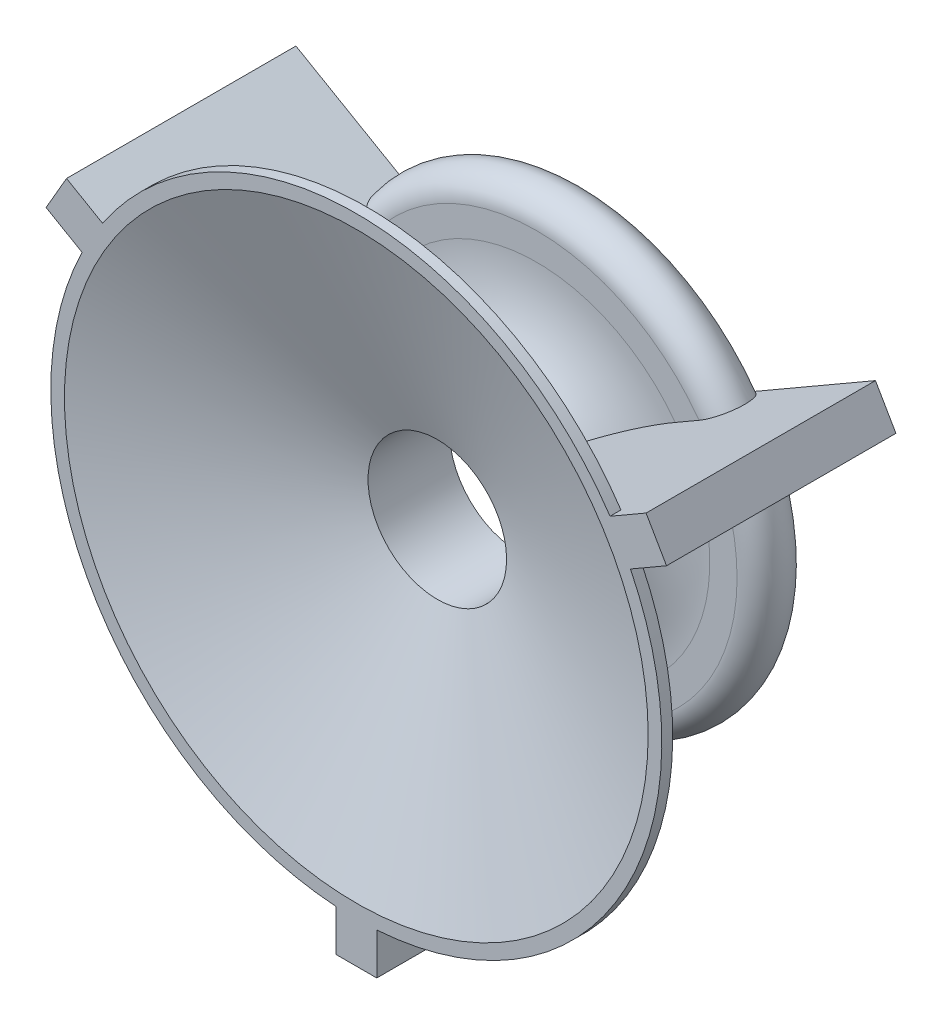
from build123d import *

# Parameters (mm, degrees)
BOSS_EXTRUDE2_DEPTH = 7.5
CIRPATTERN1_COUNT   = 3


with BuildPart() as part:
    # Sketch1 → Revolve1 (revolve)
    with BuildSketch(Plane.YZ):
        with BuildLine():
            Line((-107, 34.699971116), (-112, 34.699971116))
            Line((-112, 34.699971116), (-112, 30.699971116))
            Line((-112, 30.699971116), (-107.705307923, 30.699971116))
            Line((-107.705307923, 30.699971116), (-30.4, 2.563140081))
            Line((-30.4, 2.563140081), (-30.4, -19.471112681))
            ThreePointArc((-30.4, -19.471112681), (-45.908039104, -28.32676528), (-63.5, -31.4))
            Line((-63.5, -31.4), (-73.5, -31.4))
            ThreePointArc((-73.5, -31.4), (-82.5, -40.4), (-73.5, -49.4))
            Line((-73.5, -49.4), (-63.5, -49.4))
            Line((-63.5, -49.4), (-63.5, -45.4))
            Line((-63.5, -45.4), (-73.5, -45.4))
            ThreePointArc((-73.5, -45.4), (-78.5, -40.4), (-73.5, -35.4))
            Line((-73.5, -35.4), (-63.5, -35.4))
            ThreePointArc((-63.5, -35.4), (-46.370880058, -32.710274545), (-30.890538183, -24.9))
            Line((-30.890538183, -24.9), (-25.4, -24.9))
            Line((-25.4, -24.9), (-25.4, 5))
            Line((-25.4, 5), (-107, 34.699971116))
        make_face()
    revolve(axis=Axis((0, 0, 59.888434314), (0, 0, -1)))

    # Sketch1<4> → Boss-Extrude2 (add, symmetric)
    with BuildSketch(Plane.YZ):
        with BuildLine():
            Line((-127, 34.699971116), (-127, -49.4))
            Line((-127, -49.4), (-63.5, -49.4))
            Line((-63.5, -49.4), (-63.5, -45.4))
            Line((-63.5, -45.4), (-73.5, -45.4))
            ThreePointArc((-73.5, -45.4), (-78.5, -40.4), (-73.5, -35.4))
            Line((-73.5, -35.4), (-63.5, -35.4))
            ThreePointArc((-63.5, -35.4), (-43.026785792, -31.514964088), (-25.4, -20.4))
            Line((-25.4, -20.4), (-25.4, 5))
            Line((-25.4, 5), (-107, 34.699971116))
            Line((-107, 34.699971116), (-127, 34.699971116))
        make_face()
    boss_extrude2 = extrude(amount=BOSS_EXTRUDE2_DEPTH, both=True)

    # CirPattern1: Boss-Extrude2 ×3 about axis
    cirpattern1_axis = Axis((0, 0, 59.888434314), (0, 0, -1))
    for i in range(1, CIRPATTERN1_COUNT):
        add(boss_extrude2.rotate(cirpattern1_axis, i * 360 / CIRPATTERN1_COUNT))


solid = part.part
